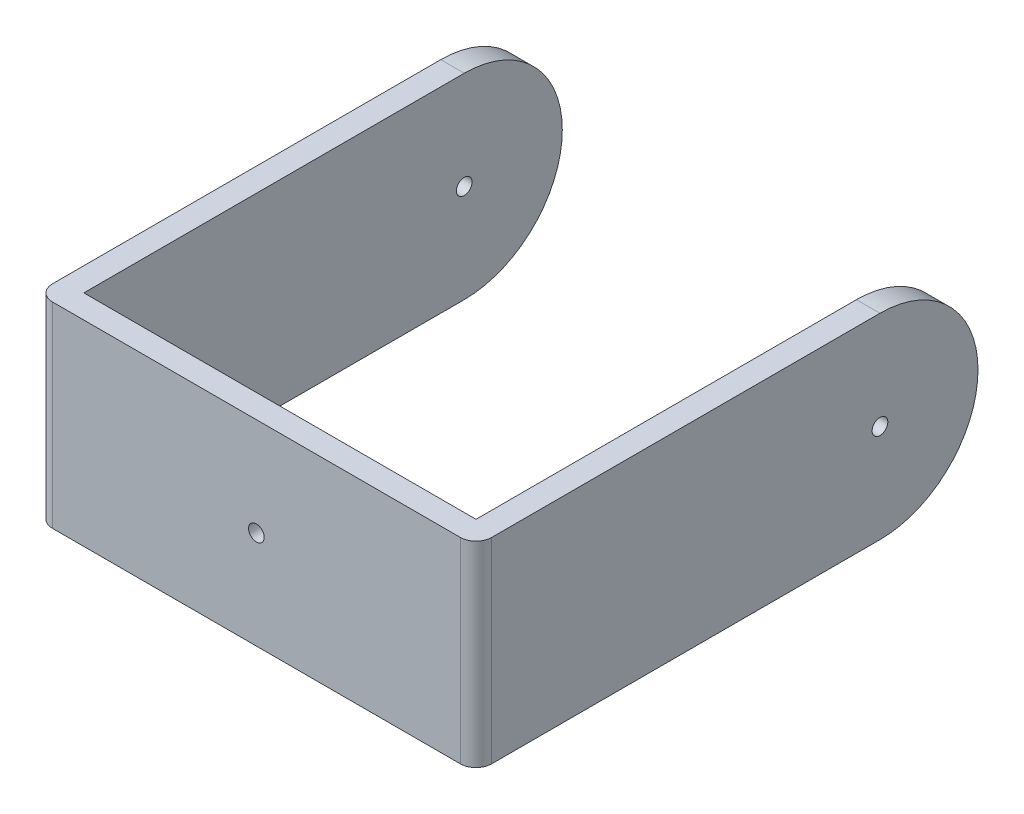
from build123d import *

# Parameters (mm, degrees)
BOSS_EXTRUDE1_DEPTH = 25
FILLET1_RADIUS      = 12.5
FILLET1_LENGTH      = 3
FILLET2_RADIUS      = 12.5
FILLET2_LENGTH      = 3
CUT_EXTRUDE1_DEPTH  = 89.639720216
CUT_EXTRUDE2_REACH  = 90.64


with BuildPart() as part:
    # Sketch1 → Boss-Extrude1 (new body)
    with BuildSketch(Plane(origin=(0, 0, 0), x_dir=(1, 0, 0), z_dir=(0, 1, 0))):
        with BuildLine():
            Line((0, 0), (0, -62))
            ThreePointArc((0, -62), (0.585786438, -63.414213562), (2, -64))
            Line((2, -64), (54, -64))
            ThreePointArc((54, -64), (55.414213562, -63.414213562), (56, -62))
            Line((56, -62), (56, 0))
            Line((56, 0), (53, 0))
            Line((53, 0), (53, -61))
            Line((53, -61), (3, -61))
            Line((3, -61), (3, 0))
            Line((3, 0), (0, 0))
        make_face()
    extrude(amount=BOSS_EXTRUDE1_DEPTH)

    # Fillet1: full round fillet: the end face becomes a half cylinder, R = half its width
    fillet1_face = Plane((1.5, 12.5, 0), x_dir=(-1, 0, 0), z_dir=(0, 0, -1))  # on the end face: x along it, z out of the body
    fillet1_slab = fillet1_face.offset(-FILLET1_RADIUS / 2) * Box(FILLET1_LENGTH, 2 * FILLET1_RADIUS, FILLET1_RADIUS, mode=Mode.PRIVATE)  # the body's end, R deep
    fillet1_round = Plane((1.5, 12.5, 12.5), x_dir=(0, 0, -1), z_dir=(-1, 0, 0)) * Cylinder(FILLET1_RADIUS, FILLET1_LENGTH, mode=Mode.PRIVATE)  # its axis R under the face
    add(fillet1_slab - fillet1_round, mode=Mode.SUBTRACT)

    # Fillet2: full round fillet: the end face becomes a half cylinder, R = half its width
    fillet2_face = Plane((54.5, 12.5, 0), x_dir=(-1, 0, 0), z_dir=(0, 0, -1))  # on the end face: x along it, z out of the body
    fillet2_slab = fillet2_face.offset(-FILLET2_RADIUS / 2) * Box(FILLET2_LENGTH, 2 * FILLET2_RADIUS, FILLET2_RADIUS, mode=Mode.PRIVATE)  # the body's end, R deep
    fillet2_round = Plane((54.5, 12.5, 12.5), x_dir=(0, 0, -1), z_dir=(-1, 0, 0)) * Cylinder(FILLET2_RADIUS, FILLET2_LENGTH, mode=Mode.PRIVATE)  # its axis R under the face
    add(fillet2_slab - fillet2_round, mode=Mode.SUBTRACT)

    # Sketch3 → Cut-Extrude1 (cut, through all)
    with BuildSketch(Plane.ZY):
        with BuildLine():
            ThreePointArc((13.5, 12.5), (13.207106781, 13.207106781), (12.5, 13.5))
            Line((12.5, 13.5), (12.5, 11.5))
            ThreePointArc((12.5, 11.5), (13.207106781, 11.792893219), (13.5, 12.5))
        make_face()
        with BuildLine():
            Line((12.5, 11.5), (12.5, 13.5))
            ThreePointArc((12.5, 13.5), (11.5, 12.5), (12.5, 11.5))
        make_face()
    extrude(amount=-CUT_EXTRUDE1_DEPTH, mode=Mode.SUBTRACT)

    # Sketch4 → Cut-Extrude2 (cut, up to next)
    with BuildSketch(Plane.XY.offset(64), mode=Mode.PRIVATE) as cut_extrude2_sk1:
        with BuildLine():
            ThreePointArc((29, 12.5), (28, 13.5), (27, 12.5))
            Line((27, 12.5), (29, 12.5))
        make_face()
    cut_extrude2_tool1 = extrude(cut_extrude2_sk1.sketch, amount=-CUT_EXTRUDE2_REACH, mode=Mode.PRIVATE) & part.part
    # Sketch4 → Cut-Extrude2 (cut, up to next)
    with BuildSketch(Plane.XY.offset(64), mode=Mode.PRIVATE) as cut_extrude2_sk2:
        with BuildLine():
            Line((29, 12.5), (27, 12.5))
            ThreePointArc((27, 12.5), (28, 11.5), (29, 12.5))
        make_face()
    cut_extrude2_tool2 = extrude(cut_extrude2_sk2.sketch, amount=-CUT_EXTRUDE2_REACH, mode=Mode.PRIVATE) & part.part
    # Sketch4 → Cut-Extrude2 (cut, up to next)
    with BuildSketch(Plane.XY.offset(64), mode=Mode.PRIVATE) as cut_extrude2_sk3:
        with BuildLine():
            ThreePointArc((29, 12.5), (28, 13.5), (27, 12.5))
            Line((27, 12.5), (29, 12.5))
        make_face()
    cut_extrude2_tool3 = extrude(cut_extrude2_sk3.sketch, amount=-CUT_EXTRUDE2_REACH, mode=Mode.PRIVATE) & part.part
    # Sketch4 → Cut-Extrude2 (cut, up to next)
    with BuildSketch(Plane.XY.offset(64), mode=Mode.PRIVATE) as cut_extrude2_sk4:
        with BuildLine():
            Line((29, 12.5), (27, 12.5))
            ThreePointArc((27, 12.5), (28, 11.5), (29, 12.5))
        make_face()
    cut_extrude2_tool4 = extrude(cut_extrude2_sk4.sketch, amount=-CUT_EXTRUDE2_REACH, mode=Mode.PRIVATE) & part.part
    add(cut_extrude2_tool1.solids().sort_by_distance((28, 12.924413, 64))[0], mode=Mode.SUBTRACT)
    add(cut_extrude2_tool2.solids().sort_by_distance((28, 12.075587, 64))[0], mode=Mode.SUBTRACT)
    add(cut_extrude2_tool3.solids().sort_by_distance((28, 12.924413, 64))[0], mode=Mode.SUBTRACT)
    add(cut_extrude2_tool4.solids().sort_by_distance((28, 12.075587, 64))[0], mode=Mode.SUBTRACT)


solid = part.part
